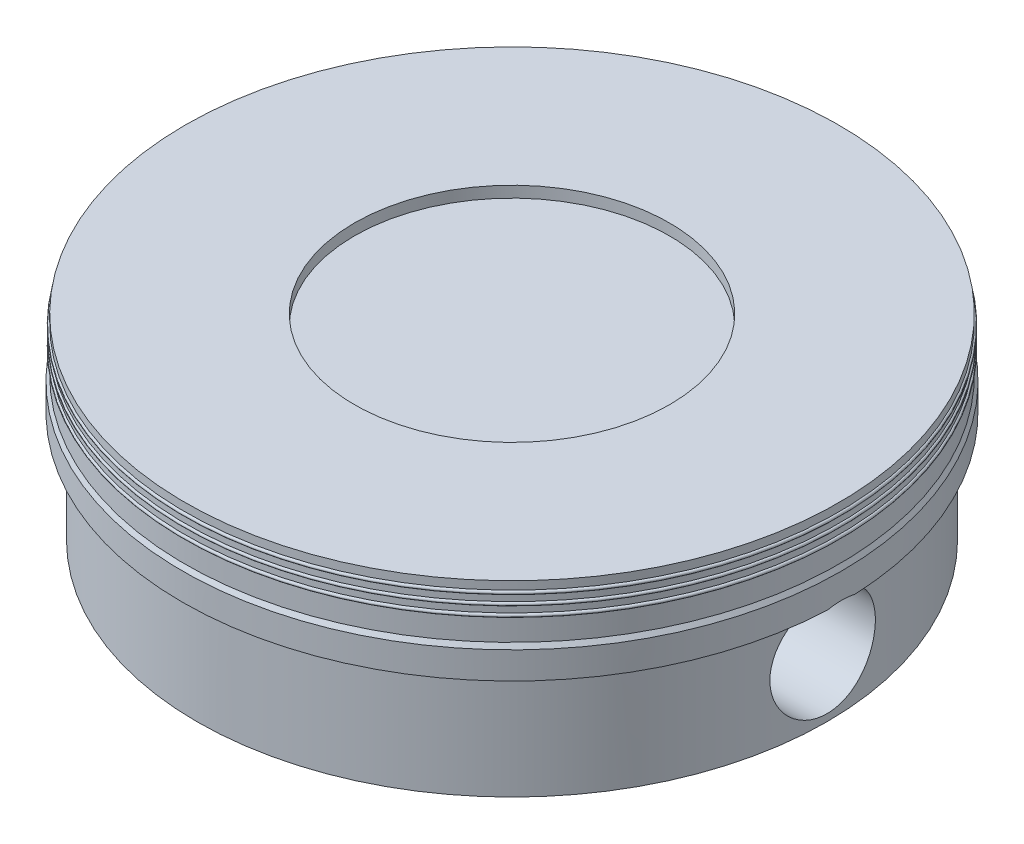
from build123d import *

# Parameters (mm, degrees)
BOSS_EXTRUDE1_REACH     = 9.669
CUT_EXTRUDE1_DEPTH      = 8.66947847
CUT_EXTRUDE1_DEPTH_BACK = 8.66947847
SKETCH4_R               = 0.8


with BuildPart() as part:
    # Sketch1 → Revolve1 (revolve)
    with BuildSketch(Plane.XY, mode=Mode.PRIVATE) as revolve1_sk:
        with BuildLine():
            Line((4.78, 0), (3.43, 0))
            Line((3.43, 0), (3.43, 1.93))
            Line((3.43, 1.93), (4.2, 1.93))
            Line((4.2, 1.93), (4.2, 2.33))
            Line((4.2, 2.33), (0, 2.33))
            Line((0, 2.33), (0, 2.8))
            Line((0, 2.8), (2.39, 2.8))
            Line((2.39, 2.8), (2.39, 2.97))
            Line((2.39, 2.97), (4.96, 2.97))
            Line((4.96, 2.97), (4.96, 2.846462681))
            ThreePointArc((4.96, 2.846462681), (4.986462681, 2.82), (4.96, 2.793537319))
            Line((4.96, 2.793537319), (4.96, 2.69523669))
            ThreePointArc((4.96, 2.69523669), (4.98523669, 2.67), (4.96, 2.64476331))
            Line((4.96, 2.64476331), (4.96, 2.546462681))
            ThreePointArc((4.96, 2.546462681), (4.986462681, 2.52), (4.96, 2.493537319))
            Line((4.96, 2.493537319), (4.96, 2.16))
            Line((4.96, 2.16), (5, 2.09))
            Line((5, 2.09), (5, 1.68))
            Line((5, 1.68), (4.78, 1.68))
            Line((4.78, 1.68), (4.78, 0))
        make_face()
    revolve(revolve1_sk.sketch.rotate(Axis((0, 3, 0), (0, -1, 0)), 180), axis=Axis((0, 3, 0), (0, -1, 0)))

    # Sketch3 → Boss-Extrude1 (add, up to next)
    with BuildSketch(Plane.XZ, mode=Mode.PRIVATE) as boss_extrude1_sk1:
        with BuildLine():
            Line((-1.75, 2.949983051), (-1.75, -2.949983051))
            ThreePointArc((-1.75, -2.949983051), (-3.43, 0), (-1.75, 2.949983051))
        make_face()
    boss_extrude1_tool1 = extrude(boss_extrude1_sk1.sketch, amount=-BOSS_EXTRUDE1_REACH, mode=Mode.PRIVATE) - part.part
    # Sketch3 → Boss-Extrude1 (add, up to next)
    with BuildSketch(Plane.XZ, mode=Mode.PRIVATE) as boss_extrude1_sk2:
        with BuildLine():
            Line((1.75, 2.949983051), (1.75, -2.949983051))
            ThreePointArc((1.75, -2.949983051), (3.43, 0), (1.75, 2.949983051))
        make_face()
    boss_extrude1_tool2 = extrude(boss_extrude1_sk2.sketch, amount=-BOSS_EXTRUDE1_REACH, mode=Mode.PRIVATE) - part.part
    add(boss_extrude1_tool1.solids().sort_by_distance((-2.438465, 0, 0))[0])
    add(boss_extrude1_tool2.solids().sort_by_distance((2.438465, 0, 0))[0])

    # Sketch4 → Cut-Extrude1 (cut, two sides: drawn at the far end of the back side and taken through both)
    with BuildSketch(Plane(origin=(0, 0, 0), x_dir=(0, 0, -1), z_dir=(1, 0, 0)).offset(-CUT_EXTRUDE1_DEPTH_BACK)):
        with Locations(Location((0, 0.9065, 0), (0, 0, 75.211580723))):
            Circle(SKETCH4_R)
    extrude(amount=CUT_EXTRUDE1_DEPTH + CUT_EXTRUDE1_DEPTH_BACK, mode=Mode.SUBTRACT)


solid = part.part
